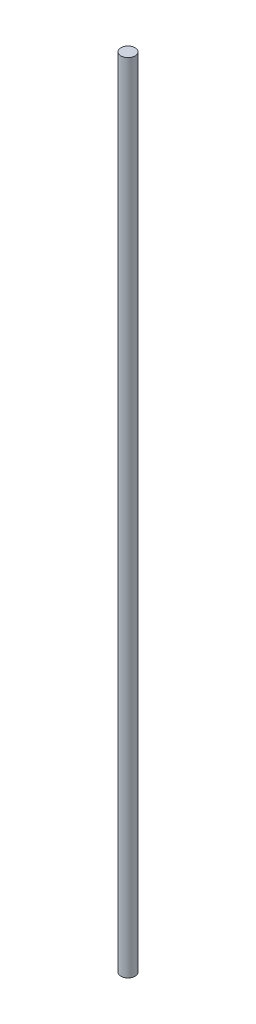
from build123d import *

# Parameters (mm, degrees)
BOSS_EXTRUDE1_DEPTH      = 250
BOSS_EXTRUDE1_DEPTH_BACK = 31.0216604
SKETCH1_R                = 2.5


with BuildPart() as part:
    # Sketch1 → Boss-Extrude1 (new, two sides: drawn at the far end of the back side and taken through both)
    with BuildSketch(Plane(origin=(0, 0, 0), x_dir=(1, 0, 0), z_dir=(0, 1, 0)).offset(-BOSS_EXTRUDE1_DEPTH_BACK)):
        with Locations(Location((0, 0, 0), (0, 0, 270))):
            Circle(SKETCH1_R)
    extrude(amount=BOSS_EXTRUDE1_DEPTH + BOSS_EXTRUDE1_DEPTH_BACK)


solid = part.part
